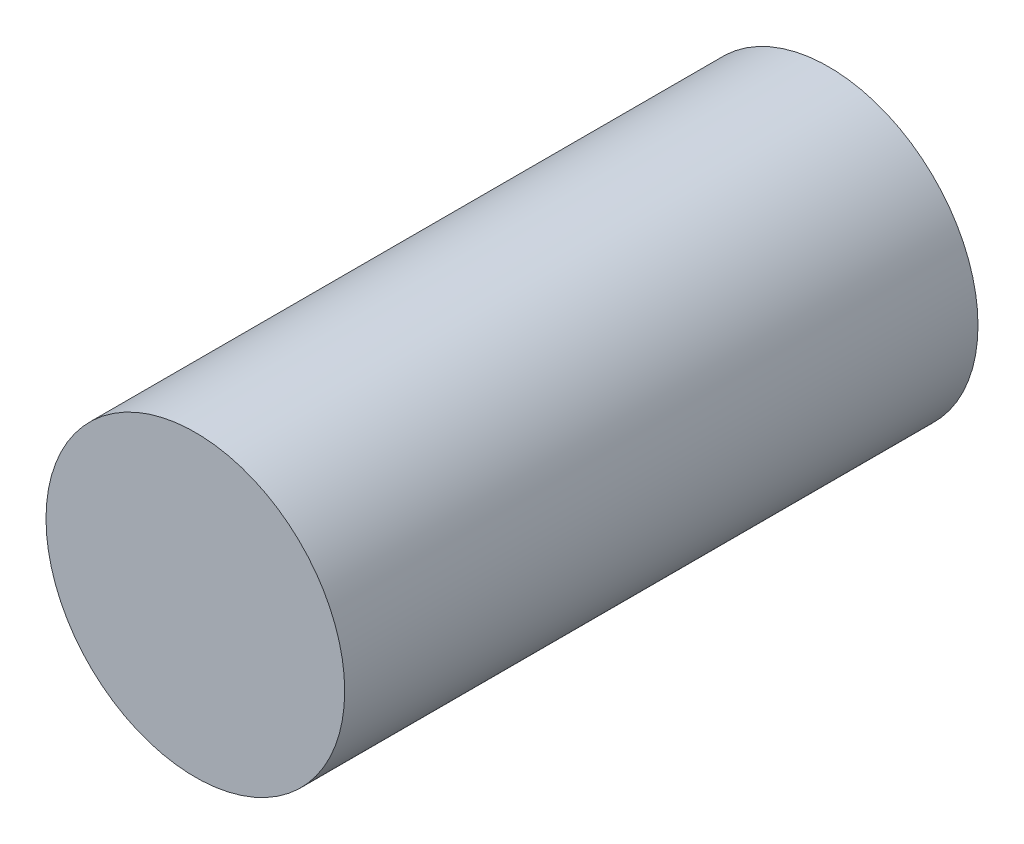
from build123d import *

# Parameters (mm, degrees)
SKETCH1_R           = 1.778
BOSS_EXTRUDE1_DEPTH = 7.539999906


with BuildPart() as part:
    # Sketch1 → Boss-Extrude1 (new body)
    with BuildSketch(Plane.XY):
        Circle(SKETCH1_R)
    extrude(amount=BOSS_EXTRUDE1_DEPTH)


solid = part.part
